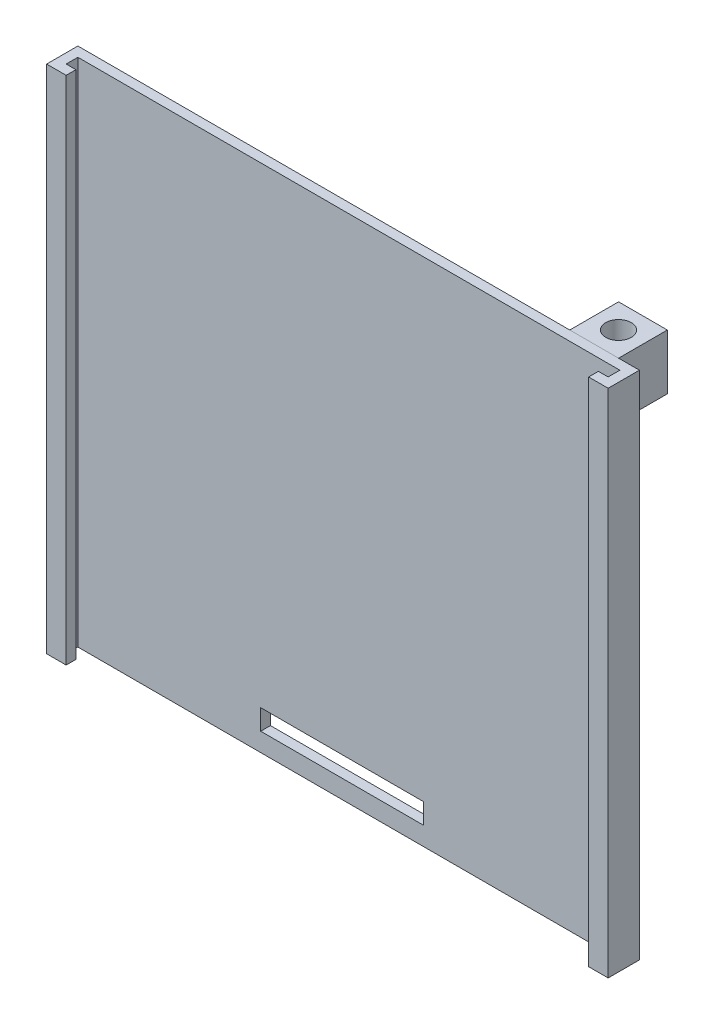
from build123d import *

# Parameters (mm, degrees)
SKETCH2_W           = 211.582
SKETCH2_H           = 203.2
BOSS_EXTRUDE1_DEPTH = 3.81
SKETCH4_W           = 12.192
SKETCH4_H           = 203.2
BOSS_EXTRUDE2_DEPTH = 3.81
SKETCH5_W           = 12.192
SKETCH5_H           = 203.2
BOSS_EXTRUDE3_DEPTH = 3.81
SKETCH6_W           = 3.81
SKETCH6_H           = 203.2
BOSS_EXTRUDE4_DEPTH = 3.81
SKETCH7_W           = 3.81
SKETCH7_H           = 203.2
BOSS_EXTRUDE5_DEPTH = 3.81
SKETCH9_W           = 254.111946297
SKETCH9_H           = 63.326566198
CUT_EXTRUDE1_DEPTH  = 3.81
SKETCH10_W          = 19.05
SKETCH10_H          = 21.59
BOSS_EXTRUDE6_DEPTH = 19.05
SKETCH11_R          = 5
CUT_EXTRUDE2_DEPTH  = 21.59
SKETCH13_W          = 63.5
SKETCH13_H          = 7.966641974
CUT_EXTRUDE3_DEPTH  = 3.81


with BuildPart() as part:
    # Sketch2 → Boss-Extrude1 (new body)
    with BuildSketch(Plane.XY):
        Rectangle(SKETCH2_W, SKETCH2_H)
    extrude(amount=BOSS_EXTRUDE1_DEPTH)

    # Sketch4 → Boss-Extrude2 (add)
    with BuildSketch(Plane.ZY.offset(105.791)):
        with Locations((6.096, 0)):
            Rectangle(SKETCH4_W, SKETCH4_H)
    extrude(amount=BOSS_EXTRUDE2_DEPTH)

    # Sketch5 → Boss-Extrude3 (add)
    with BuildSketch(Plane(origin=(105.791, 0, 0), x_dir=(0, 0, -1), z_dir=(1, 0, 0))):
        with Locations((-6.096, 0)):
            Rectangle(SKETCH5_W, SKETCH5_H)
    extrude(amount=BOSS_EXTRUDE3_DEPTH)

    # Sketch6 → Boss-Extrude4 (add)
    with BuildSketch(Plane.ZY.offset(-105.791)):
        with Locations((10.287, 0)):
            Rectangle(SKETCH6_W, SKETCH6_H)
    extrude(amount=BOSS_EXTRUDE4_DEPTH)

    # Sketch7 → Boss-Extrude5 (add)
    with BuildSketch(Plane(origin=(-105.791, 0, 0), x_dir=(0, 0, -1), z_dir=(1, 0, 0))):
        with Locations((-10.287, 0)):
            Rectangle(SKETCH7_W, SKETCH7_H)
    extrude(amount=BOSS_EXTRUDE5_DEPTH)

    # Sketch9 → Cut-Extrude1 (cut)
    with BuildSketch(Plane(origin=(0, 101.6, 0), x_dir=(1, 0, 0), z_dir=(0, 1, 0))):
        with Locations((-4.27011197, -1.772499308)):
            Rectangle(SKETCH9_W, SKETCH9_H)
    extrude(amount=-CUT_EXTRUDE1_DEPTH, mode=Mode.SUBTRACT)

    # Sketch13 → Cut-Extrude3 (cut)
    with BuildSketch(Plane(origin=(0, 0, 0), x_dir=(-1, 0, 0), z_dir=(0, 0, -1))):
        with Locations((2.667, -90.391630491)):
            Rectangle(SKETCH13_W, SKETCH13_H)
    extrude(amount=-CUT_EXTRUDE3_DEPTH, mode=Mode.SUBTRACT)


with BuildPart() as body_2:
    # Sketch10 → Boss-Extrude6 (new body)
    with BuildSketch(Plane(origin=(0, 0, 0), x_dir=(-1, 0, 0), z_dir=(0, 0, -1))):
        with Locations((-91.948, 86.995)):
            Rectangle(SKETCH10_W, SKETCH10_H)
    extrude(amount=BOSS_EXTRUDE6_DEPTH)

    # Sketch11 → Cut-Extrude2 (cut)
    with BuildSketch(Plane(origin=(0, 97.79, 0), x_dir=(1, 0, 0), z_dir=(0, 1, 0))):
        with Locations(Location((91.948, 9.525, 0), (0, 0, 270))):
            Circle(SKETCH11_R)
    extrude(amount=-CUT_EXTRUDE2_DEPTH, mode=Mode.SUBTRACT)


solid = Compound([part.part, body_2.part])
